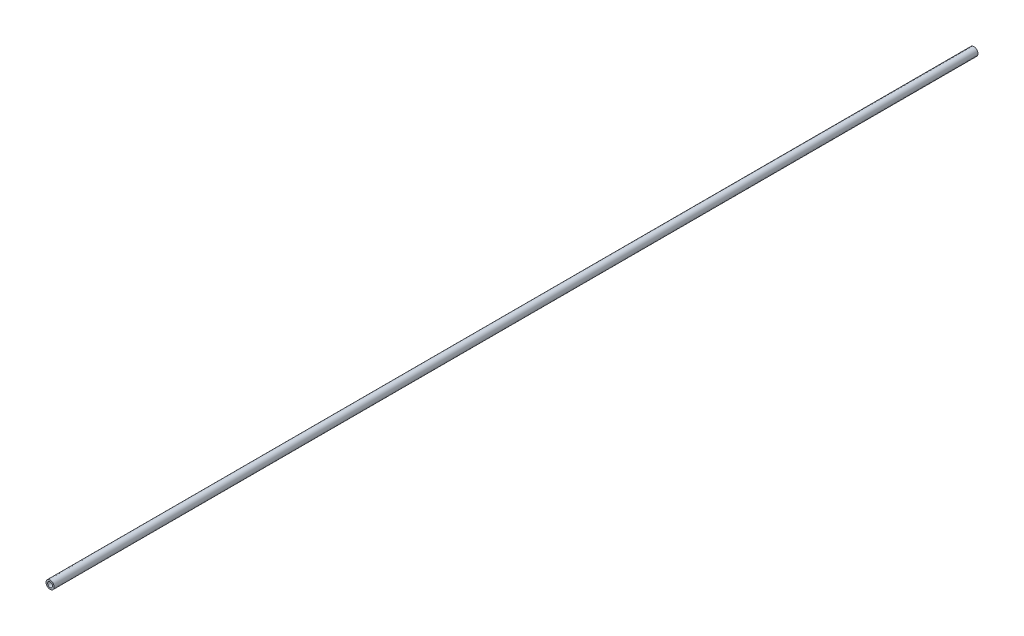
from build123d import *

# Parameters (mm, degrees)
SKETCH2_R           = 12.7
BOSS_EXTRUDE2_DEPTH = 2874.856702476
SKETCH4_R           = 7.62
CUT_EXTRUDE2_DEPTH  = 2874.856702476


with BuildPart() as part:
    # Sketch2 → Boss-Extrude2 (new body)
    with BuildSketch(Plane.XY):
        Circle(SKETCH2_R)
    extrude(amount=BOSS_EXTRUDE2_DEPTH)

    # Sketch4 → Cut-Extrude2 (cut)
    with BuildSketch(Plane(origin=(0, 0, 0), x_dir=(-1, 0, 0), z_dir=(0, 0, -1))):
        Circle(SKETCH4_R)
    extrude(amount=-CUT_EXTRUDE2_DEPTH, mode=Mode.SUBTRACT)


solid = part.part
